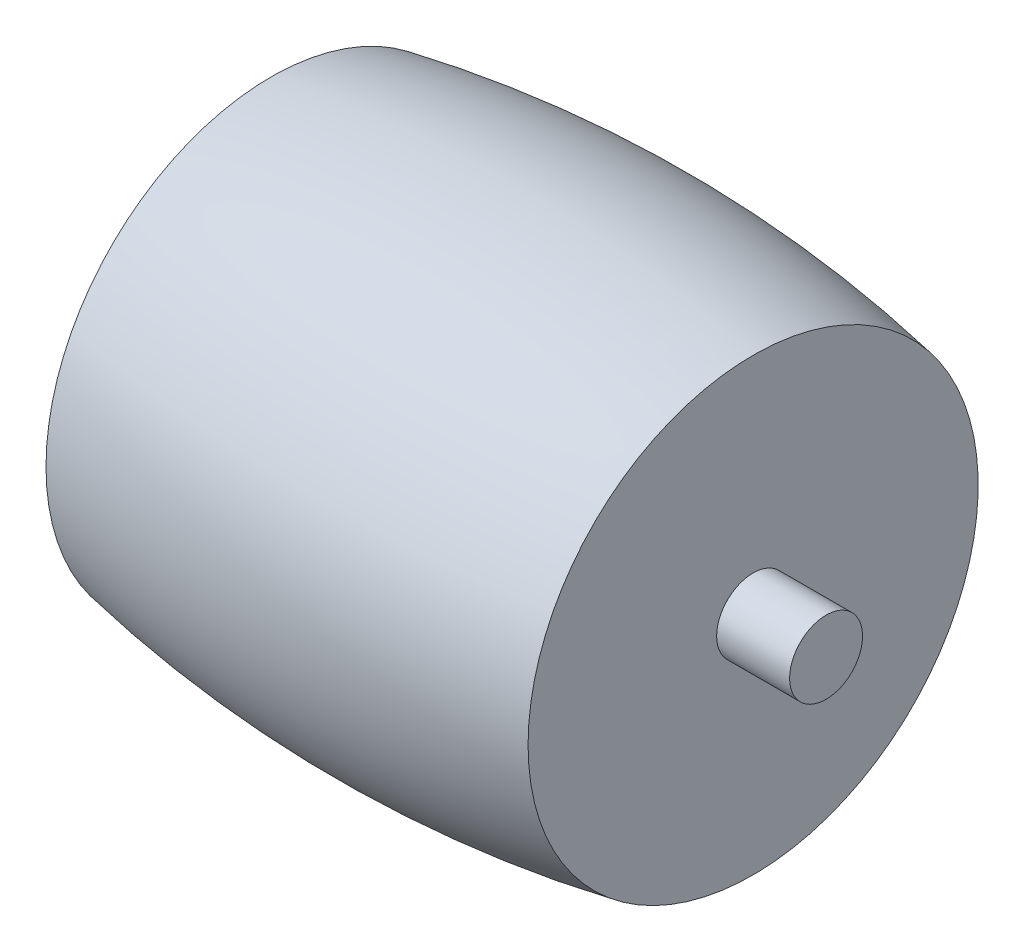
from build123d import *


with BuildPart() as part:
    # Sketch1 → Revolve1 (revolve)
    with BuildSketch(Plane.XY, mode=Mode.PRIVATE) as revolve1_sk:
        with BuildLine():
            Line((9.25, 49.136926033), (9.25, 41.9))
            Line((9.25, 41.9), (12.05, 41.9))
            Line((12.05, 41.9), (12.05, 40.5))
            Line((12.05, 40.5), (9.25, 40.5))
            Line((9.25, 40.5), (-9.25, 40.5))
            Line((-9.25, 40.5), (-12.05, 40.5))
            Line((-12.05, 40.5), (-12.05, 41.9))
            Line((-12.05, 41.9), (-9.25, 41.9))
            Line((-9.25, 41.9), (-9.25, 49.136926033))
            ThreePointArc((-9.25, 49.136926033), (0, 50), (9.25, 49.136926033))
        make_face()
    revolve(revolve1_sk.sketch.rotate(Axis((-9.25, 40.5, 0), (1, 0, 0)), 90), axis=Axis((-9.25, 40.5, 0), (1, 0, 0)))


solid = part.part
